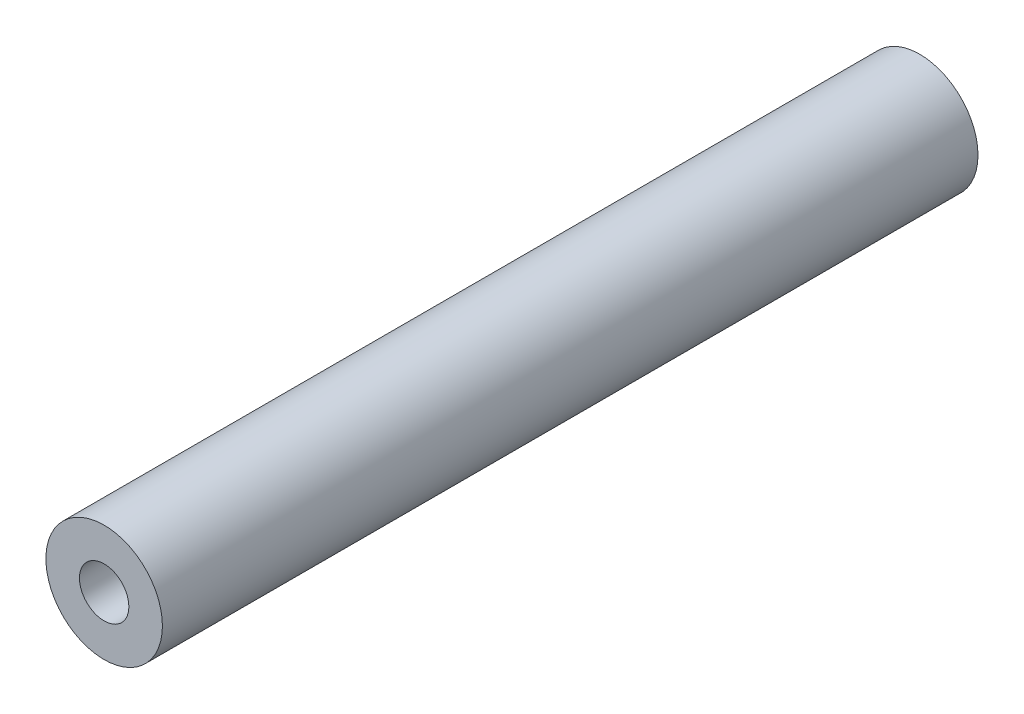
from build123d import *

# Parameters (mm, degrees)
SKETCH1_R                            = 4.7625
BOSS_EXTRUDE1_DEPTH                  = 33.3375
F_10_32_TAPPED_HOLE1_D               = 4.0386
F_10_32_TAPPED_HOLE1_DEPTH           = 11.938
F_10_32_TAPPED_HOLE1_TIP             = 1.213317848
F_10_32_TAPPED_HOLE1_ON_FACE_2_D     = 4.0386
F_10_32_TAPPED_HOLE1_ON_FACE_2_DEPTH = 11.938
F_10_32_TAPPED_HOLE1_ON_FACE_2_TIP   = 1.213317848


with BuildPart() as part:
    # Sketch1 → Boss-Extrude1 (new, symmetric)
    with BuildSketch(Plane.XY):
        Circle(SKETCH1_R)
    extrude(amount=BOSS_EXTRUDE1_DEPTH, both=True)

    # #10-32 Tapped Hole1
    with Locations(Plane.XY.offset(33.3375)):
        with Locations((0, 0)):
            Hole(F_10_32_TAPPED_HOLE1_D / 2, depth=F_10_32_TAPPED_HOLE1_DEPTH)
            with Locations((0, 0, -(F_10_32_TAPPED_HOLE1_DEPTH + F_10_32_TAPPED_HOLE1_TIP / 2))):  # 118° drill point
                Cone(0, F_10_32_TAPPED_HOLE1_D / 2, F_10_32_TAPPED_HOLE1_TIP, mode=Mode.SUBTRACT)

    # #10-32 Tapped Hole1 on face 2
    with Locations(Plane(origin=(0, 0, -33.3375), x_dir=(-1, 0, 0), z_dir=(0, 0, -1))):
        with Locations((0, 0)):
            Hole(F_10_32_TAPPED_HOLE1_ON_FACE_2_D / 2, depth=F_10_32_TAPPED_HOLE1_ON_FACE_2_DEPTH)
            with Locations((0, 0, -(F_10_32_TAPPED_HOLE1_ON_FACE_2_DEPTH + F_10_32_TAPPED_HOLE1_ON_FACE_2_TIP / 2))):  # 118° drill point
                Cone(0, F_10_32_TAPPED_HOLE1_ON_FACE_2_D / 2, F_10_32_TAPPED_HOLE1_ON_FACE_2_TIP, mode=Mode.SUBTRACT)


solid = part.part
